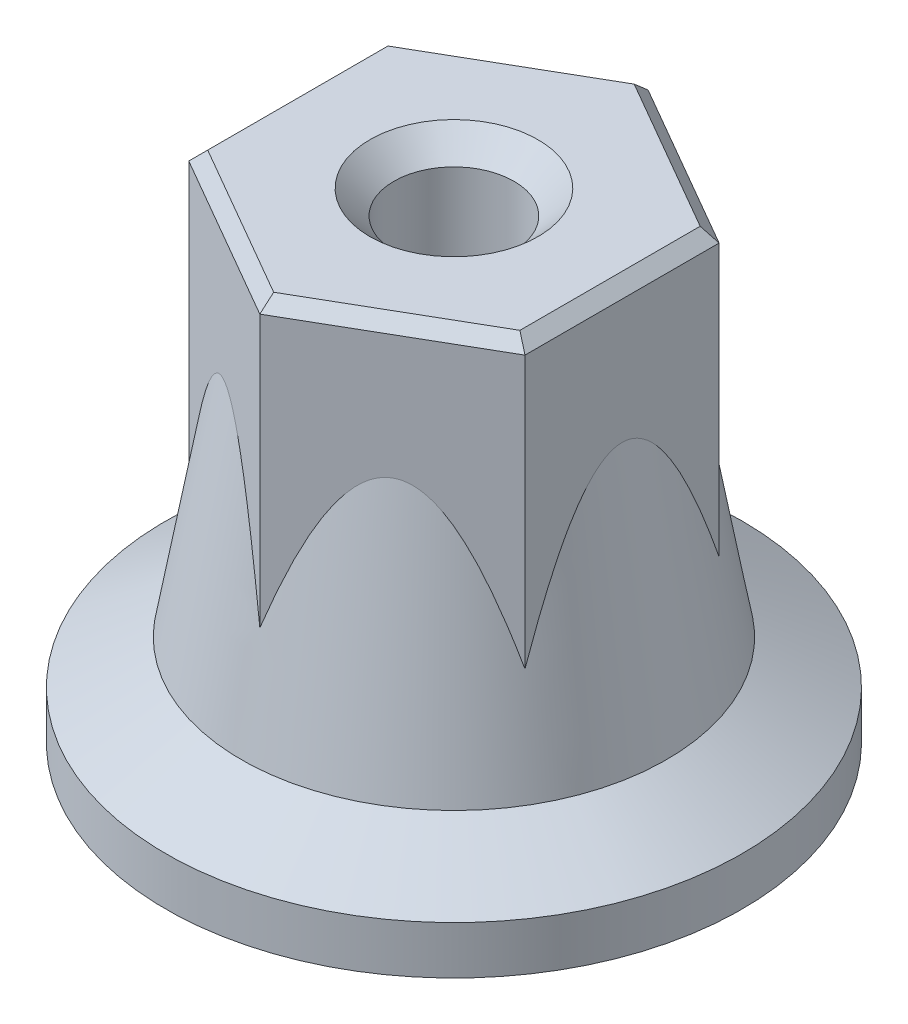
from build123d import *

# Parameters (mm, degrees)
CHAMFER1_SIZE         = 1
SKETCH2_R             = 6
BOSS_EXTRUDE1_DEPTH   = 15
CHAMFER2_SIZE         = 0.5
F_5_0MM_DOWEL_HOLE1_D = 5


with BuildPart() as part:
    # Sketch1 → Revolve1 (revolve)
    with BuildSketch(Plane.XY, mode=Mode.PRIVATE) as revolve1_sk:
        Polygon((2.5, 15.517957554), (6, 15.517957554), (8.853571596, -0.66545116), (12, -2.482042446), (12, -4.482042446), (11.116055663, -4.482042446), (10.718293105, -3.566194226), (9.374682102, -4.487525743), (7.83057192, -3.153662628), (6.678328492, -4.487525743), (4.849032939, -4.487525743), (3.335400026, -4.487525743), (2.39653501, -3.879149231), (1.705781249, -4.482042446), (0, -4.482042446), (0, 0), (2.5, 0), align=None)
    revolve(revolve1_sk.sketch.rotate(Axis((0, -4.482042446, 0), (0, 1, 0)), 90), axis=Axis((0, -4.482042446, 0), (0, 1, 0)))

    # Chamfer1
    chamfer1_edges = [part.edges().sort_by_distance(p)[0] for p in [
        (0, 15.517957554, 2.5),
    ]]
    chamfer(chamfer1_edges, length=CHAMFER1_SIZE)

    # Sketch2 → Boss-Extrude1 (add)
    with BuildSketch(Plane(origin=(0, 15.517957554, 0), x_dir=(1, 0, 0), z_dir=(0, 1, 0))):
        Polygon((0, 8.082903769), (-7, 4.041451884), (-7, -4.041451884), (0, -8.082903769), (7, -4.041451884), (7, 4.041451884), align=None)
        Circle(SKETCH2_R, mode=Mode.SUBTRACT)
    extrude(amount=-BOSS_EXTRUDE1_DEPTH)

    # Chamfer2
    chamfer2_edges = [part.edges().sort_by_distance(p)[0] for p in [
        (3.5, 15.517957554, -6.062177826),
        (-3.5, 15.517957554, -6.062177826),
        (-7, 15.517957554, 0),
        (-3.5, 15.517957554, 6.062177826),
        (3.5, 15.517957554, 6.062177826),
        (7, 15.517957554, 0),
    ]]
    chamfer(chamfer2_edges, length=CHAMFER2_SIZE)

    # Ø5.0mm Dowel Hole1 (through all)
    with Locations(Plane(origin=(0, -4.482042446, 0), x_dir=(-1, 0, 0), z_dir=(0, -1, 0))):
        with Locations((0, 0)):
            Hole(F_5_0MM_DOWEL_HOLE1_D / 2)


solid = part.part
